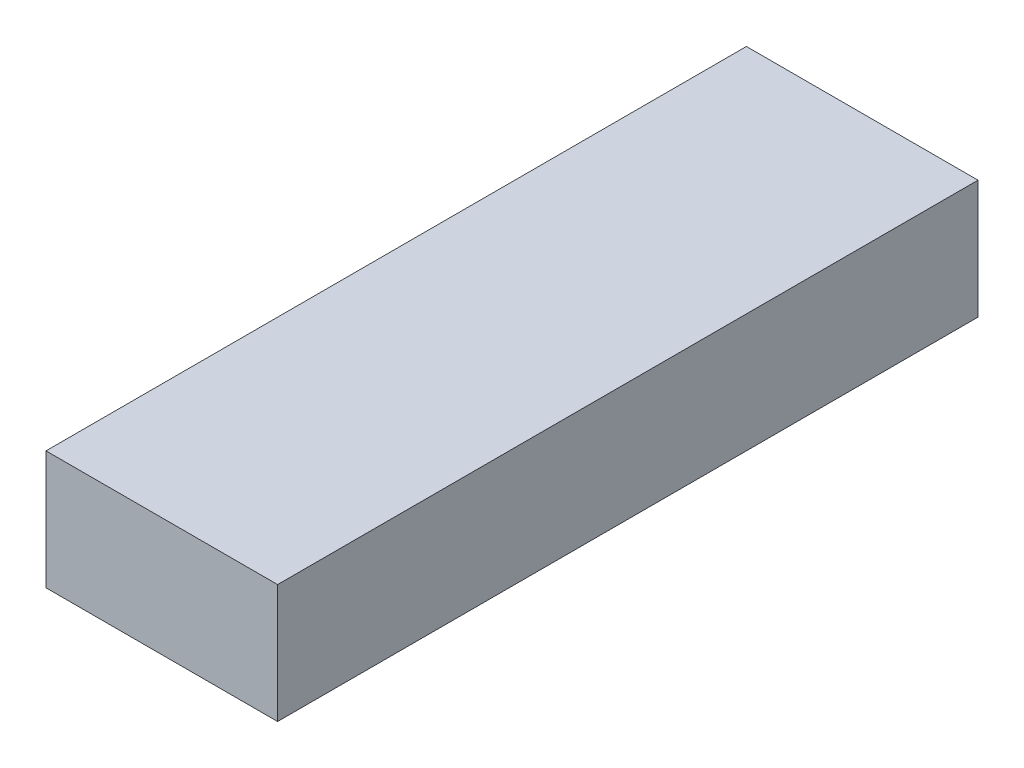
from build123d import *

# Parameters (mm, degrees)
SKETCH1_W           = 41
SKETCH1_H           = 21
BOSS_EXTRUDE1_DEPTH = 124


with BuildPart() as part:
    # Sketch1 → Boss-Extrude1 (new body)
    with BuildSketch(Plane.XY):
        Rectangle(SKETCH1_W, SKETCH1_H)
    extrude(amount=BOSS_EXTRUDE1_DEPTH)


solid = part.part
